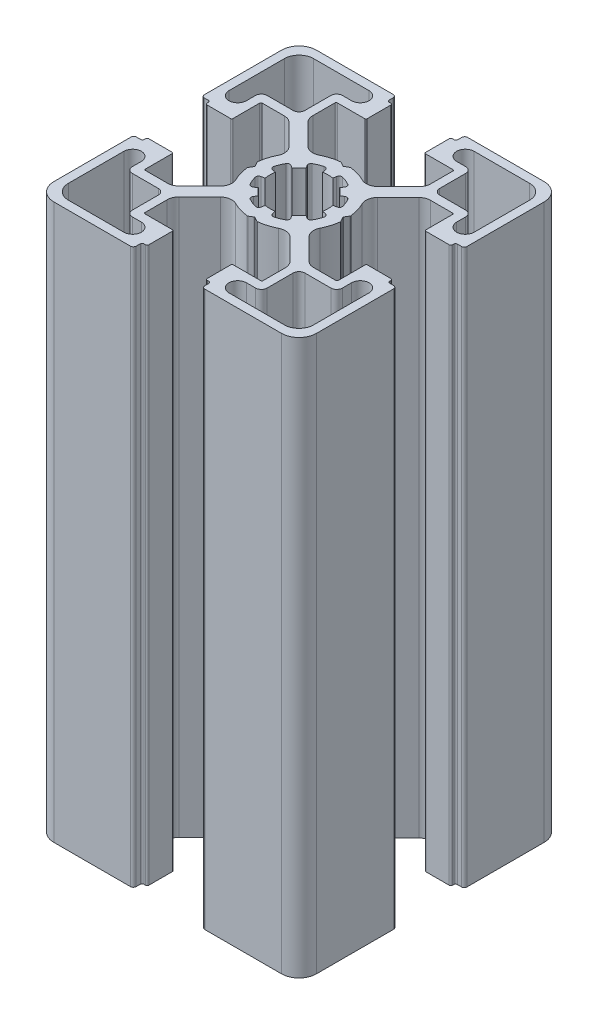
from build123d import *

# Parameters (mm, degrees)
BOSS_EXTRUDE1_DEPTH = 95


with BuildPart() as part:
    # Sketch1 → Boss-Extrude1 (new body)
    with BuildSketch(Plane(origin=(0, 0, 0), x_dir=(1, 0, 0), z_dir=(0, 1, 0))):
        with BuildLine():
            Line((7.563483841, 5.858695924), (11.129779796, 9.424987881))
            ThreePointArc((11.129779796, 9.424987881), (11.76062452, 9.846504465), (12.504756421, 9.994521395))
            Line((12.504756421, 9.994521395), (16.316902359, 9.994521395))
            ThreePointArc((16.316902359, 9.994521395), (16.458323963, 9.935942648), (16.51690271, 9.794521044))
            Line((16.51690271, 9.794521044), (16.51690271, 5.20001408))
            ThreePointArc((16.51690271, 5.20001408), (16.575481456, 5.058592476), (16.716903061, 5.000013729))
            Line((16.716903061, 5.000013729), (20.719599813, 5.000013729))
            ThreePointArc((20.719599813, 5.000013729), (20.931731335, 5.087881483), (21.019599089, 5.300013005))
            Line((21.019599089, 5.300013005), (21.019599089, 5.500003954))
            ThreePointArc((21.019599089, 5.500003954), (21.107466988, 5.71213583), (21.319598864, 5.800003729))
            Line((21.319598864, 5.800003729), (21.999979422, 5.800003729))
            ThreePointArc((21.999979422, 5.800003729), (22.353532548, 5.946450229), (22.499979048, 6.300003356))
            Line((22.499979048, 6.300003356), (22.499979048, 19.500015971))
            ThreePointArc((22.499979048, 19.500015971), (21.621300048, 21.62133473), (19.499981289, 22.50001373))
            Line((19.499981289, 22.50001373), (6.37570892, 22.50001373))
            ThreePointArc((6.37570892, 22.50001373), (6.022155794, 22.35356723), (5.875709294, 22.000014103))
            Line((5.875709294, 22.000014103), (5.875709294, 21.300013005))
            ThreePointArc((5.875709294, 21.300013005), (5.78784154, 21.087881482), (5.575710018, 21.000013729))
            Line((5.575710018, 21.000013729), (5.299998684, 21.000013729))
            ThreePointArc((5.299998684, 21.000013729), (5.087867516, 20.912146122), (4.999999909, 20.700014953))
            Line((4.999999909, 20.700014953), (4.999999909, 16.666812288))
            ThreePointArc((4.999999909, 16.666812288), (5.058578802, 16.52539033), (5.20000076, 16.466811437))
            Line((5.20000076, 16.466811437), (9.905385127, 16.466811437))
            ThreePointArc((9.905385127, 16.466811437), (10.046806731, 16.408232691), (10.105385478, 16.266811086))
            Line((10.105385478, 16.266811086), (10.105385478, 12.471582811))
            ThreePointArc((10.105385478, 12.471582811), (9.953144497, 11.706215717), (9.519598864, 11.057368824))
            Line((9.519598864, 11.057368824), (5.944897897, 7.482667857))
            ThreePointArc((5.944897897, 7.482667857), (4.854602604, 6.96783564), (3.666501718, 7.17329201))
            ThreePointArc((3.666501718, 7.17329201), (2.308631207, 7.714000899), (0.875344921, 8.000128222))
            ThreePointArc((0.875344921, 8.000128222), (0.813048151, 7.996979672), (0.754751151, 7.974792726))
            Line((0.754751151, 7.974792726), (0.112630526, 7.606936313))
            ThreePointArc((0.112630526, 7.606936313), (0.062965968, 7.559088119), (2.065e-06, 7.530953356))
            ThreePointArc((2.065e-06, 7.530953356), (-0.062961837, 7.559088119), (-0.112626394, 7.606936313))
            Line((-0.112626394, 7.606936313), (-0.754745572, 7.974791896))
            ThreePointArc((-0.754745572, 7.974791896), (-0.813042564, 7.99697884), (-0.875339325, 8.000127394))
            ThreePointArc((-0.875339325, 8.000127394), (-2.308625867, 7.714000103), (-3.666496612, 7.173291142))
            ThreePointArc((-3.666496612, 7.173291142), (-4.854599203, 6.967834938), (-5.944895348, 7.482669215))
            Line((-5.944895348, 7.482669215), (-9.519596331, 11.057370197))
            ThreePointArc((-9.519596331, 11.057370197), (-9.953141964, 11.70621709), (-10.105382945, 12.471584185))
            Line((-10.105382945, 12.471584185), (-10.105382945, 16.266811086))
            ThreePointArc((-10.105382945, 16.266811086), (-10.046804198, 16.408232691), (-9.905382594, 16.466811437))
            Line((-9.905382594, 16.466811437), (-5.200000942, 16.466811437))
            ThreePointArc((-5.200000942, 16.466811437), (-5.058578984, 16.52539033), (-5.000000091, 16.666812288))
            Line((-5.000000091, 16.666812288), (-5.000000091, 20.700014953))
            ThreePointArc((-5.000000091, 20.700014953), (-5.087867699, 20.912146122), (-5.299998867, 21.000013729))
            Line((-5.299998867, 21.000013729), (-5.575710202, 21.000013729))
            ThreePointArc((-5.575710202, 21.000013729), (-5.787841724, 21.087881482), (-5.875709478, 21.300013005))
            Line((-5.875709478, 21.300013005), (-5.875709478, 22.000014104))
            ThreePointArc((-5.875709478, 22.000014104), (-6.022155978, 22.35356723), (-6.375709104, 22.50001373))
            Line((-6.375709104, 22.50001373), (-19.499981473, 22.50001373))
            ThreePointArc((-19.499981473, 22.50001373), (-21.621300232, 21.62133473), (-22.499979232, 19.500015971))
            Line((-22.499979232, 19.500015971), (-22.499979232, 6.300003356))
            ThreePointArc((-22.499979232, 6.300003356), (-22.353532732, 5.946450229), (-21.999979605, 5.800003729))
            Line((-21.999979605, 5.800003729), (-21.319599047, 5.800003729))
            ThreePointArc((-21.319599047, 5.800003729), (-21.107467171, 5.71213583), (-21.019599271, 5.500003954))
            Line((-21.019599271, 5.500003954), (-21.019599271, 5.300013005))
            ThreePointArc((-21.019599271, 5.300013005), (-20.931731518, 5.087881483), (-20.719599995, 5.000013729))
            Line((-20.719599995, 5.000013729), (-16.716903244, 5.000013729))
            ThreePointArc((-16.716903244, 5.000013729), (-16.57548164, 5.058592476), (-16.516902894, 5.20001408))
            Line((-16.516902894, 5.20001408), (-16.516902894, 9.794521044))
            ThreePointArc((-16.516902894, 9.794521044), (-16.458324147, 9.935942648), (-16.316902543, 9.994521395))
            Line((-16.316902543, 9.994521395), (-12.504755574, 9.994521395))
            ThreePointArc((-12.504755574, 9.994521395), (-11.760623673, 9.846504465), (-11.129778949, 9.424987881))
            Line((-11.129778949, 9.424987881), (-7.563484024, 5.858696956))
            ThreePointArc((-7.563484024, 5.858696956), (-7.018857309, 4.793955357), (-7.200363541, 3.611860429))
            ThreePointArc((-7.200363541, 3.611860429), (-7.719534914, 2.299057702), (-7.999860794, 0.915436613))
            ThreePointArc((-7.999860794, 0.915436613), (-7.996805132, 0.851929863), (-7.97397167, 0.792591196))
            Line((-7.97397167, 0.792591196), (-7.540055962, 0.046829926))
            ThreePointArc((-7.540055962, 0.046829926), (-7.534291471, 0.023676009), (-7.531325428, 3.7e-07))
            ThreePointArc((-7.531325428, 3.7e-07), (-7.534291471, -0.023675268), (-7.540055962, -0.046829185))
            Line((-7.540055962, -0.046829185), (-7.97397167, -0.792590455))
            ThreePointArc((-7.97397167, -0.792590455), (-7.996805132, -0.851929122), (-7.999860794, -0.915435872))
            ThreePointArc((-7.999860794, -0.915435872), (-7.719534914, -2.299056961), (-7.200363541, -3.611859688))
            ThreePointArc((-7.200363541, -3.611859688), (-7.018857309, -4.793954616), (-7.563484024, -5.858696215))
            Line((-7.563484024, -5.858696215), (-11.12977998, -9.424988171))
            ThreePointArc((-11.12977998, -9.424988171), (-11.760624704, -9.846504756), (-12.504756605, -9.994521685))
            Line((-12.504756605, -9.994521685), (-16.316902543, -9.994521685))
            ThreePointArc((-16.316902543, -9.994521685), (-16.458324147, -9.935942938), (-16.516902894, -9.794521334))
            Line((-16.516902894, -9.794521334), (-16.516902894, -5.200014371))
            ThreePointArc((-16.516902894, -5.200014371), (-16.57548164, -5.058592767), (-16.716903244, -5.000014021))
            Line((-16.716903244, -5.000014021), (-20.719599995, -5.000014021))
            ThreePointArc((-20.719599995, -5.000014021), (-20.931731518, -5.087881774), (-21.019599271, -5.300013296))
            Line((-21.019599271, -5.300013296), (-21.019599271, -5.500004245))
            ThreePointArc((-21.019599271, -5.500004245), (-21.107467171, -5.71213612), (-21.319599047, -5.80000402))
            Line((-21.319599047, -5.80000402), (-21.999979605, -5.80000402))
            ThreePointArc((-21.999979605, -5.80000402), (-22.353532732, -5.94645052), (-22.499979232, -6.300003647))
            Line((-22.499979232, -6.300003647), (-22.499979232, -19.500016261))
            ThreePointArc((-22.499979232, -19.500016261), (-21.621300232, -21.62133502), (-19.499981473, -22.50001402))
            Line((-19.499981473, -22.50001402), (-6.375709104, -22.50001402))
            ThreePointArc((-6.375709104, -22.50001402), (-6.022155978, -22.35356752), (-5.875709478, -22.000014394))
            Line((-5.875709478, -22.000014394), (-5.875709478, -21.300013295))
            ThreePointArc((-5.875709478, -21.300013295), (-5.787841724, -21.087881773), (-5.575710202, -21.000014019))
            Line((-5.575710202, -21.000014019), (-5.299998867, -21.000014019))
            ThreePointArc((-5.299998867, -21.000014019), (-5.087867699, -20.912146412), (-5.000000091, -20.700015244))
            Line((-5.000000091, -20.700015244), (-5.000000091, -16.666812578))
            ThreePointArc((-5.000000091, -16.666812578), (-5.058578984, -16.52539062), (-5.200000942, -16.466811727))
            Line((-5.200000942, -16.466811727), (-9.905382594, -16.466811727))
            ThreePointArc((-9.905382594, -16.466811727), (-10.046804198, -16.40823298), (-10.105382945, -16.266811376))
            Line((-10.105382945, -16.266811376), (-10.105382945, -12.471581681))
            ThreePointArc((-10.105382945, -12.471581681), (-9.953141964, -11.706214586), (-9.519596331, -11.057367693))
            Line((-9.519596331, -11.057367693), (-5.944895364, -7.482666726))
            ThreePointArc((-5.944895364, -7.482666726), (-4.854601518, -6.967832762), (-3.66650075, -7.173286521))
            ThreePointArc((-3.66650075, -7.173286521), (-2.30862839, -7.713996836), (-0.875339942, -8.000124808))
            ThreePointArc((-0.875339942, -8.000124808), (-0.81304361, -7.99697628), (-0.754747019, -7.97478949))
            Line((-0.754747019, -7.97478949), (-0.112626395, -7.606933078))
            ThreePointArc((-0.112626395, -7.606933078), (-0.062961838, -7.559084884), (2.065e-06, -7.530950121))
            ThreePointArc((2.065e-06, -7.530950121), (0.062965968, -7.559084884), (0.112630526, -7.606933078))
            Line((0.112630526, -7.606933078), (0.754751151, -7.974789491))
            ThreePointArc((0.754751151, -7.974789491), (0.813048151, -7.996976437), (0.875344921, -8.000124987))
            ThreePointArc((0.875344921, -8.000124987), (2.308629801, -7.71399808), (3.666499103, -7.173290103))
            ThreePointArc((3.666499103, -7.173290103), (4.854601719, -6.967833865), (5.944897897, -7.482668146))
            Line((5.944897897, -7.482668146), (9.519598864, -11.057369113))
            ThreePointArc((9.519598864, -11.057369113), (9.953144497, -11.706216006), (10.105385478, -12.471583101))
            Line((10.105385478, -12.471583101), (10.105385478, -16.266811376))
            ThreePointArc((10.105385478, -16.266811376), (10.046806731, -16.40823298), (9.905385127, -16.466811727))
            Line((9.905385127, -16.466811727), (5.20000076, -16.466811727))
            ThreePointArc((5.20000076, -16.466811727), (5.058578802, -16.52539062), (4.999999909, -16.666812578))
            Line((4.999999909, -16.666812578), (4.999999909, -20.700015244))
            ThreePointArc((4.999999909, -20.700015244), (5.087867516, -20.912146412), (5.299998684, -21.000014019))
            Line((5.299998684, -21.000014019), (5.575710018, -21.000014019))
            ThreePointArc((5.575710018, -21.000014019), (5.78784154, -21.087881773), (5.875709294, -21.300013295))
            Line((5.875709294, -21.300013295), (5.875709294, -22.000014394))
            ThreePointArc((5.875709294, -22.000014394), (6.022155794, -22.35356752), (6.37570892, -22.50001402))
            Line((6.37570892, -22.50001402), (19.499981289, -22.50001402))
            ThreePointArc((19.499981289, -22.50001402), (21.621300048, -21.62133502), (22.499979048, -19.500016261))
            Line((22.499979048, -19.500016261), (22.499979048, -6.300003646))
            ThreePointArc((22.499979048, -6.300003646), (22.353532548, -5.94645052), (21.999979422, -5.80000402))
            Line((21.999979422, -5.80000402), (21.319598864, -5.80000402))
            ThreePointArc((21.319598864, -5.80000402), (21.107466988, -5.71213612), (21.019599089, -5.500004245))
            Line((21.019599089, -5.500004245), (21.019599089, -5.300013297))
            ThreePointArc((21.019599089, -5.300013297), (20.931731335, -5.087881774), (20.719599813, -5.000014021))
            Line((20.719599813, -5.000014021), (16.716903061, -5.000014021))
            ThreePointArc((16.716903061, -5.000014021), (16.575481456, -5.058592767), (16.51690271, -5.200014371))
            Line((16.51690271, -5.200014371), (16.51690271, -9.794521334))
            ThreePointArc((16.51690271, -9.794521334), (16.458323963, -9.935942938), (16.316902359, -9.994521685))
            Line((16.316902359, -9.994521685), (12.504756421, -9.994521685))
            ThreePointArc((12.504756421, -9.994521685), (11.76062452, -9.846504756), (11.129779797, -9.424988171))
            Line((11.129779797, -9.424988171), (7.56348384, -5.858696215))
            ThreePointArc((7.56348384, -5.858696215), (7.018857125, -4.793954616), (7.200363357, -3.611859689))
            ThreePointArc((7.200363357, -3.611859689), (7.71953473, -2.299056961), (7.99986061, -0.915435872))
            ThreePointArc((7.99986061, -0.915435872), (7.996804948, -0.851929122), (7.973971486, -0.792590456))
            Line((7.973971486, -0.792590456), (7.54005578, -0.046829188))
            ThreePointArc((7.54005578, -0.046829188), (7.53429135, -0.023675779), (7.531325245, -6.6e-07))
            ThreePointArc((7.531325245, -6.6e-07), (7.534291289, 0.023674979), (7.54005578, 0.046828898))
            Line((7.54005578, 0.046828898), (7.973971486, 0.792590166))
            ThreePointArc((7.973971486, 0.792590166), (7.996804949, 0.851928832), (7.99986061, 0.915435582))
            ThreePointArc((7.99986061, 0.915435582), (7.719534731, 2.299056671), (7.200363358, 3.611859399))
            ThreePointArc((7.200363358, 3.611859399), (7.018857126, 4.793954326), (7.563483841, 5.858695924))
        make_face()
        with BuildLine():
            Line((-17.99997923, 9.000204729), (-17.99997923, 10.550013476))
            ThreePointArc((-17.99997923, 10.550013476), (-17.70708623, 11.257119729), (-16.999979977, 11.550012729))
            Line((-16.999979977, 11.550012729), (-12.549977483, 11.550012729))
            ThreePointArc((-12.549977483, 11.550012729), (-11.84287123, 11.842905729), (-11.54997823, 12.550011982))
            Line((-11.54997823, 12.550011982), (-11.54997823, 17.000014476))
            ThreePointArc((-11.54997823, 17.000014476), (-11.25708523, 17.707120729), (-10.549978977, 18.000013729))
            Line((-10.549978977, 18.000013729), (-8.99997923, 18.000013729))
            ThreePointArc((-8.99997923, 18.000013729), (-7.49997923, 19.500013729), (-8.99997923, 21.000013729))
            Line((-8.99997923, 21.000013729), (-18.499981098, 21.000013729))
            ThreePointArc((-18.499981098, 21.000013729), (-20.26774673, 20.267781229), (-20.99997923, 18.500015597))
            Line((-20.99997923, 18.500015597), (-20.99997923, 9.000204729))
            ThreePointArc((-20.99997923, 9.000204729), (-19.49997923, 7.500204729), (-17.99997923, 9.000204729))
        make_face(mode=Mode.SUBTRACT)
        with BuildLine():
            Line((0.967518273, 5.481094418), (0.867385333, 4.924170439))
            ThreePointArc((0.867385333, 4.924170439), (-3.404e-06, 4.999981493), (-0.867392141, 4.924170439))
            Line((-0.867392141, 4.924170439), (-0.967525085, 5.48109443))
            ThreePointArc((-0.967525085, 5.48109443), (-1.18787304, 5.829596016), (-1.595121059, 5.894060173))
            ThreePointArc((-1.595121059, 5.894060173), (-2.337474987, 5.644060679), (-3.0416713, 5.300991221))
            ThreePointArc((-3.0416713, 5.300991221), (-3.284300912, 4.965857552), (-3.191387249, 4.562681715))
            Line((-3.191387249, 4.562681715), (-2.864003826, 4.098457013))
            ThreePointArc((-2.864003826, 4.098457013), (-3.530136355, 3.540908116), (-4.089716295, 2.876480837))
            Line((-4.089716295, 2.876480837), (-4.566781049, 3.208143991))
            ThreePointArc((-4.566781049, 3.208143991), (-4.968981864, 3.298752353), (-5.302521511, 3.056416481))
            ThreePointArc((-5.302521511, 3.056416481), (-5.650679971, 2.354692469), (-5.906040083, 1.614137194))
            ThreePointArc((-5.906040083, 1.614137194), (-5.840630787, 1.205603075), (-5.48985103, 0.986212864))
            Line((-5.48985103, 0.986212864), (-4.920549171, 0.887804317))
            ThreePointArc((-4.920549171, 0.887804317), (-5.000003405, -1.8509e-05), (-4.92054917, -0.887841334))
            Line((-4.92054917, -0.887841334), (-5.48973413, -0.986229672))
            ThreePointArc((-5.48973413, -0.986229672), (-5.84059179, -1.205595835), (-5.906027737, -1.614179668))
            ThreePointArc((-5.906027737, -1.614179668), (-5.650660878, -2.354735576), (-5.302495324, -3.056459191))
            ThreePointArc((-5.302495324, -3.056459191), (-4.968965627, -3.298777294), (-4.566781049, -3.208181006))
            Line((-4.566781049, -3.208181006), (-4.089716295, -2.876517852))
            ThreePointArc((-4.089716295, -2.876517852), (-3.530136355, -3.540945131), (-2.864003826, -4.098494028))
            Line((-2.864003826, -4.098494028), (-3.191315305, -4.562616715))
            ThreePointArc((-3.191315305, -4.562616715), (-3.284288314, -4.9658247), (-3.041645074, -5.301003633))
            ThreePointArc((-3.041645074, -5.301003633), (-2.337436005, -5.644074141), (-1.595068803, -5.894071587))
            ThreePointArc((-1.595068803, -5.894071587), (-1.187863583, -5.829591875), (-0.967525085, -5.481131446))
            Line((-0.967525085, -5.481131446), (-0.867392142, -4.924207454))
            ThreePointArc((-0.867392142, -4.924207454), (-3.405e-06, -5.000018508), (0.867385333, -4.924207454))
            Line((0.867385333, -4.924207454), (0.967518273, -5.481131433))
            ThreePointArc((0.967518273, -5.481131433), (1.187884068, -5.829612183), (1.595127065, -5.894056407))
            ThreePointArc((1.595127065, -5.894056407), (2.337463214, -5.64406402), (3.04164388, -5.301006091))
            ThreePointArc((3.04164388, -5.301006091), (3.284272431, -4.965888777), (3.191382531, -4.562721697))
            Line((3.191382531, -4.562721697), (2.863997017, -4.098494027))
            ThreePointArc((2.863997017, -4.098494027), (3.530129546, -3.540945131), (4.089709486, -2.876517851))
            Line((4.089709486, -2.876517851), (4.56677425, -3.208181013))
            ThreePointArc((4.56677425, -3.208181013), (4.968991235, -3.298778206), (5.302526078, -3.056413061))
            ThreePointArc((5.302526078, -3.056413061), (5.650679647, -2.354700627), (5.90603791, -1.614157983))
            ThreePointArc((5.90603791, -1.614157983), (5.840629826, -1.205623017), (5.489849863, -0.98623192))
            Line((5.489849863, -0.98623192), (4.920545674, -0.88782297))
            ThreePointArc((4.920545674, -0.88782297), (4.999996595, -1.94e-07), (4.92053917, 0.887822))
            Line((4.92053917, 0.887822), (5.489724104, 0.986210336))
            ThreePointArc((5.489724104, 0.986210336), (5.840595493, 1.20557008), (5.90603791, 1.614161218))
            ThreePointArc((5.90603791, 1.614161218), (5.650669489, 2.354728137), (5.302499707, 3.056461843))
            ThreePointArc((5.302499707, 3.056461843), (4.968955649, 3.298763634), (4.56677425, 3.208143998))
            Line((4.56677425, 3.208143998), (4.089709486, 2.876480836))
            ThreePointArc((4.089709486, 2.876480836), (3.530129546, 3.540908115), (2.863997017, 4.098457012))
            Line((2.863997017, 4.098457012), (3.191308496, 4.562579701))
            ThreePointArc((3.191308496, 4.562579701), (3.284310107, 4.965799272), (3.041663899, 5.300997928))
            ThreePointArc((3.041663899, 5.300997928), (2.337448292, 5.644073372), (1.595073641, 5.894073887))
            ThreePointArc((1.595073641, 5.894073887), (1.18784779, 5.829586125), (0.967518273, 5.481094418))
        make_face(mode=Mode.SUBTRACT)
        with BuildLine():
            Line((-20.99997923, -9.000205019), (-20.99997923, -18.500015887))
            ThreePointArc((-20.99997923, -18.500015887), (-20.26774673, -20.267781519), (-18.499981098, -21.000014019))
            Line((-18.499981098, -21.000014019), (-8.99997923, -21.000014019))
            ThreePointArc((-8.99997923, -21.000014019), (-7.49997923, -19.500014019), (-8.99997923, -18.000014019))
            Line((-8.99997923, -18.000014019), (-10.549978977, -18.000014019))
            ThreePointArc((-10.549978977, -18.000014019), (-11.25708523, -17.707121019), (-11.54997823, -17.000014766))
            Line((-11.54997823, -17.000014766), (-11.54997823, -12.550012272))
            ThreePointArc((-11.54997823, -12.550012272), (-11.84287123, -11.842906019), (-12.549977483, -11.550013019))
            Line((-12.549977483, -11.550013019), (-16.999979977, -11.550013019))
            ThreePointArc((-16.999979977, -11.550013019), (-17.70708623, -11.257120019), (-17.99997923, -10.550013766))
            Line((-17.99997923, -10.550013766), (-17.99997923, -9.000205019))
            ThreePointArc((-17.99997923, -9.000205019), (-19.49997923, -7.500205019), (-20.99997923, -9.000205019))
        make_face(mode=Mode.SUBTRACT)
        with BuildLine():
            Line((20.999979046, 9.000204729), (20.999979046, 18.500015597))
            ThreePointArc((20.999979046, 18.500015597), (20.267746546, 20.267781229), (18.499980914, 21.000013729))
            Line((18.499980914, 21.000013729), (8.999979046, 21.000013729))
            ThreePointArc((8.999979046, 21.000013729), (7.499979046, 19.500013729), (8.999979046, 18.000013729))
            Line((8.999979046, 18.000013729), (10.549978793, 18.000013729))
            ThreePointArc((10.549978793, 18.000013729), (11.257085046, 17.707120729), (11.549978046, 17.000014476))
            Line((11.549978046, 17.000014476), (11.549978046, 12.550011982))
            ThreePointArc((11.549978046, 12.550011982), (11.842871046, 11.842905729), (12.549977299, 11.550012729))
            Line((12.549977299, 11.550012729), (16.999979793, 11.550012729))
            ThreePointArc((16.999979793, 11.550012729), (17.707086046, 11.257119729), (17.999979046, 10.550013476))
            Line((17.999979046, 10.550013476), (17.999979046, 9.000204729))
            ThreePointArc((17.999979046, 9.000204729), (19.499979046, 7.500204729), (20.999979046, 9.000204729))
        make_face(mode=Mode.SUBTRACT)
        with BuildLine():
            Line((16.999979793, -11.550013019), (12.549977299, -11.550013019))
            ThreePointArc((12.549977299, -11.550013019), (11.842871046, -11.842906019), (11.549978046, -12.550012272))
            Line((11.549978046, -12.550012272), (11.549978046, -17.000014766))
            ThreePointArc((11.549978046, -17.000014766), (11.257085046, -17.707121019), (10.549978793, -18.000014019))
            Line((10.549978793, -18.000014019), (8.999979046, -18.000014019))
            ThreePointArc((8.999979046, -18.000014019), (7.499979046, -19.500014019), (8.999979046, -21.000014019))
            Line((8.999979046, -21.000014019), (18.499980914, -21.000014019))
            ThreePointArc((18.499980914, -21.000014019), (20.267746546, -20.267781519), (20.999979046, -18.500015887))
            Line((20.999979046, -18.500015887), (20.999979046, -9.000205019))
            ThreePointArc((20.999979046, -9.000205019), (19.499979046, -7.500205019), (17.999979046, -9.000205019))
            Line((17.999979046, -9.000205019), (17.999979046, -10.550013766))
            ThreePointArc((17.999979046, -10.550013766), (17.707086046, -11.257120019), (16.999979793, -11.550013019))
        make_face(mode=Mode.SUBTRACT)
    extrude(amount=BOSS_EXTRUDE1_DEPTH)


solid = part.part
